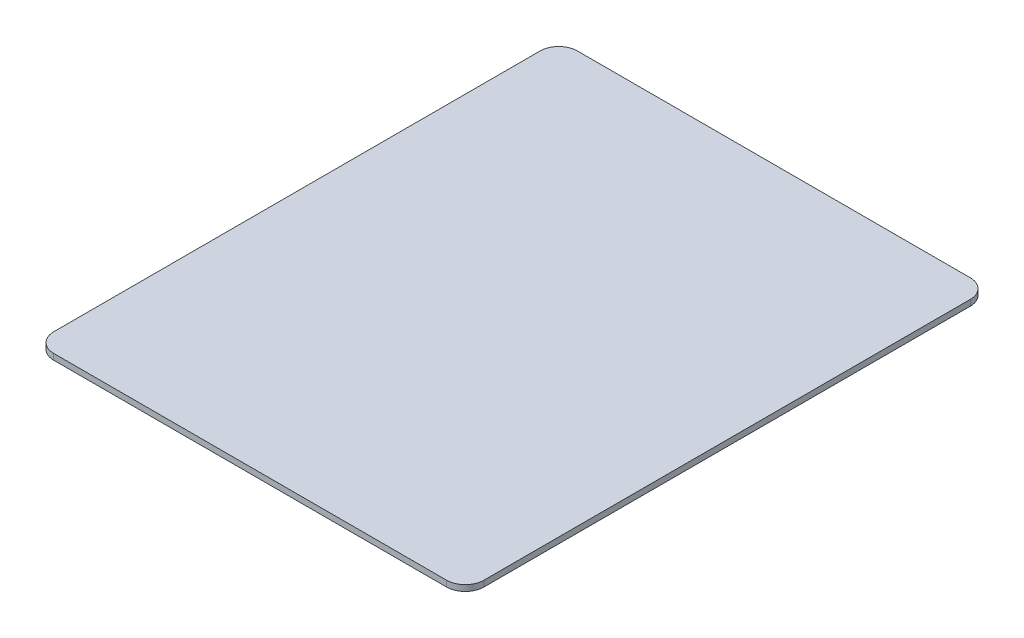
from build123d import *

# Parameters (mm, degrees)
SKETCH1_W           = 230
SKETCH1_H           = 280
BOSS_EXTRUDE1_DEPTH = 3.175
FILLET1_R           = 10


with BuildPart() as part:
    # Sketch1 → Boss-Extrude1 (new body)
    with BuildSketch(Plane(origin=(0, 0, 0), x_dir=(1, 0, 0), z_dir=(0, 1, 0))):
        Rectangle(SKETCH1_W, SKETCH1_H)
    extrude(amount=BOSS_EXTRUDE1_DEPTH)

    # Fillet1
    fillet1_edges = [part.edges().sort_by_distance(p)[0] for p in [
        (115, 1.5875, 140),
        (-115, 1.5875, 140),
        (-115, 1.5875, -140),
        (115, 1.5875, -140),
    ]]
    fillet(fillet1_edges, radius=FILLET1_R)


solid = part.part
